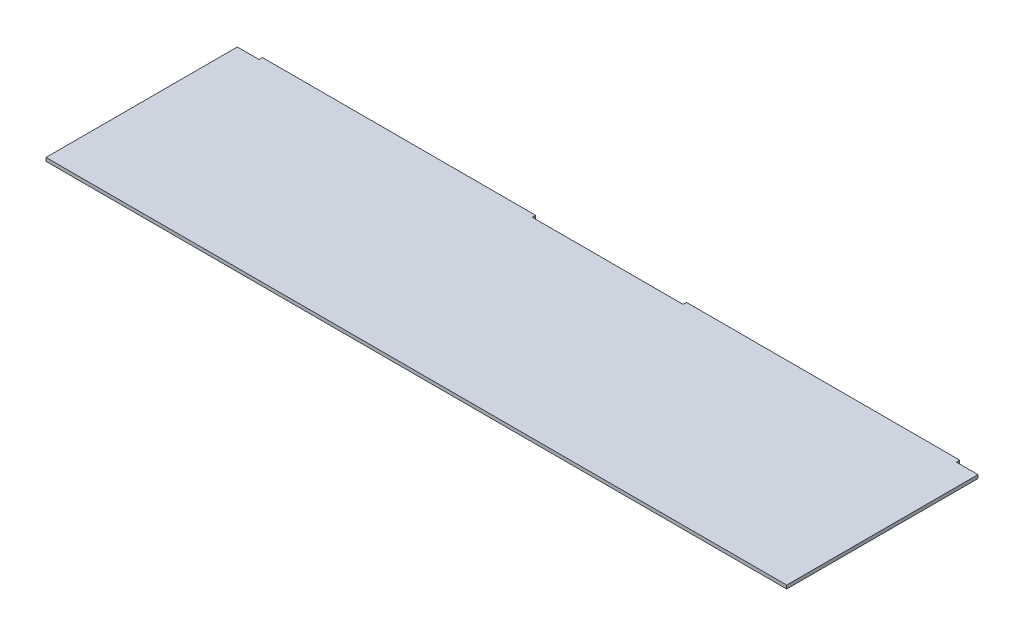
from build123d import *

# Parameters (mm, degrees)
SKETCH1_W           = 688.4416
SKETCH1_H           = 177.8
BOSS_EXTRUDE1_DEPTH = 1.5875
SKETCH2_W           = 254
SKETCH2_H           = 3.175
BOSS_EXTRUDE2_DEPTH = 3.175


with BuildPart() as part:
    # Sketch1 → Boss-Extrude1 (new, symmetric)
    with BuildSketch(Plane(origin=(0, 0, 0), x_dir=(1, 0, 0), z_dir=(0, 1, 0))):
        Rectangle(SKETCH1_W, SKETCH1_H)
    extrude(amount=BOSS_EXTRUDE1_DEPTH, both=True)

    # Sketch2 → Boss-Extrude2 (add)
    with BuildSketch(Plane(origin=(0, 0, -88.9), x_dir=(-1, 0, 0), z_dir=(0, 0, -1))):
        with Locations((-197.0659, 0)):
            Rectangle(SKETCH2_W, SKETCH2_H)
        with Locations((197.0659, 0)):
            Rectangle(SKETCH2_W, SKETCH2_H)
    extrude(amount=BOSS_EXTRUDE2_DEPTH)


solid = part.part
